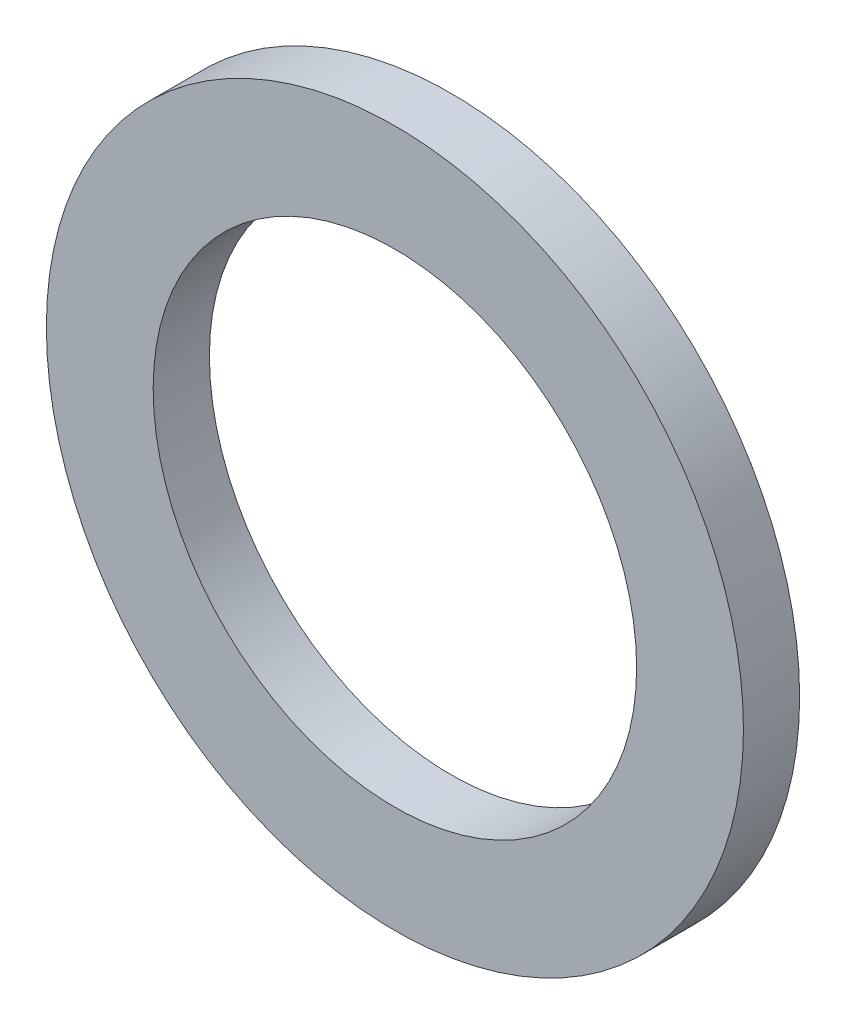
from build123d import *

# Parameters (mm, degrees)
SKETCH_1_R      = 31
SKETCH_1_R_2    = 21.5
EXTRUDE_1_DEPTH = 5


with BuildPart() as part:
    # Эскиз1 → Бобышка-Вытянуть1 (new body)
    with BuildSketch(Plane.XY):
        Circle(SKETCH_1_R)
        Circle(SKETCH_1_R_2, mode=Mode.SUBTRACT)
    extrude(amount=EXTRUDE_1_DEPTH)


solid = part.part
